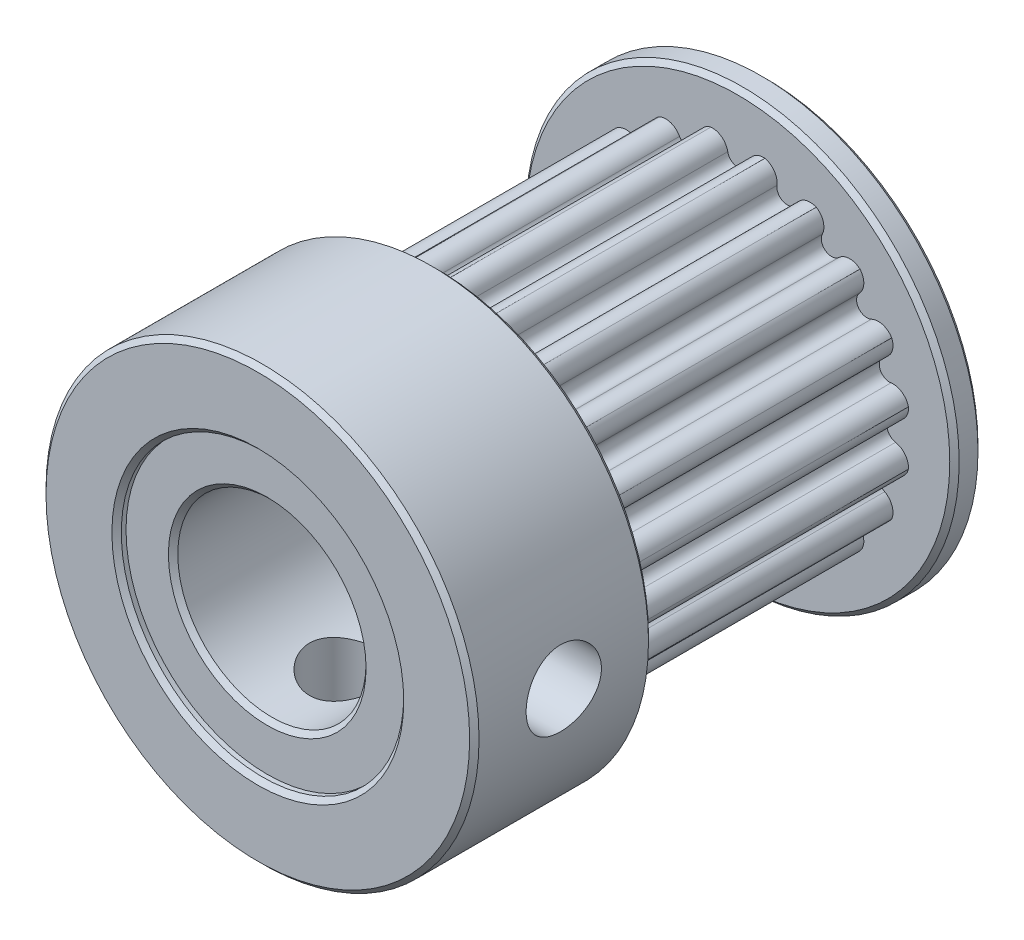
from build123d import *

# Parameters (mm, degrees)
ESQUISSE1_R                  = 11.5
ESQUISSE1_R_2                = 5
BOSS_EXTRU_1_DEPTH           = 27
ESQUISSE2_R                  = 11.5
ESQUISSE2_R_2                = 9.17
ENL_V_MAT_EXTRU_1_DEPTH      = 16
ENL_V_START                  = 16
ENL_V_MAT_EXTRU_2_DEPTH      = 16
R_P_TITION_CIRCULAIRE1_COUNT = 20
ESQUISSE4_R                  = 2
ENL_V_MAT_EXTRU_3_DEPTH      = 16
R_P_TITION_CIRCULAIRE2_COUNT = 2
R_P_TITION_CIRCULAIRE2_ANGLE = 90
ESQUISSE5_R                  = 7.5
ENL_V_MAT_EXTRU_4_DEPTH      = 0.5
CHANFREIN1_SIZE              = 0.25


with BuildPart() as part:
    # Esquisse1 → Boss.-Extru.1 (new body)
    with BuildSketch(Plane.XY):
        Circle(ESQUISSE1_R)
        Circle(ESQUISSE1_R_2, mode=Mode.SUBTRACT)
    extrude(amount=BOSS_EXTRU_1_DEPTH)

    # Esquisse2 → Enlèv. mat.-Extru.1 (cut)
    with BuildSketch(Plane(origin=(0, 0, 1.5), x_dir=(-1, 0, 0), z_dir=(0, 0, -1))):
        Circle(ESQUISSE2_R)
        Circle(ESQUISSE2_R_2, mode=Mode.SUBTRACT)
    extrude(amount=-ENL_V_MAT_EXTRU_1_DEPTH, mode=Mode.SUBTRACT)

    # Esquisse3 → Enlèv. mat.-Extru.2 (cut)
    with BuildSketch(Plane(origin=(0, 0, 17.5), x_dir=(-1, 0, 0), z_dir=(0, 0, -1)).offset(ENL_V_START)):
        with BuildLine():
            ThreePointArc((-1.5, 9.046485505), (-0.88232463, 8.905445978), (-0.541125011, 8.371594096))
            ThreePointArc((-0.541125011, 8.371594096), (0, 7.92), (0.541125011, 8.371594096))
            ThreePointArc((0.541125011, 8.371594096), (0.88232463, 8.905445978), (1.5, 9.046485505))
            ThreePointArc((1.5, 9.046485505), (0, 9.17), (-1.5, 9.046485505))
        make_face()
    enl_v_mat_extru_2 = extrude(amount=-ENL_V_MAT_EXTRU_2_DEPTH, mode=Mode.SUBTRACT)

    # Répétition circulaire1: Enlèv. mat.-Extru.2 ×20 about axis
    r_p_tition_circulaire1_axis = Axis((0, 0, 0), (0, 0, 1))
    for i in range(1, R_P_TITION_CIRCULAIRE1_COUNT):
        add(enl_v_mat_extru_2.rotate(r_p_tition_circulaire1_axis, i * 360 / R_P_TITION_CIRCULAIRE1_COUNT), mode=Mode.SUBTRACT)

    # Esquisse4 → Enlèv. mat.-Extru.3 (cut)
    with BuildSketch(Plane(origin=(0, 0, 0), x_dir=(1, 0, 0), z_dir=(0, 1, 0))):
        with Locations(Location((0, -22.25, 0), (0, 0, 270))):
            Circle(ESQUISSE4_R)
    enl_v_mat_extru_3 = extrude(amount=-ENL_V_MAT_EXTRU_3_DEPTH, mode=Mode.SUBTRACT)

    # Répétition circulaire2: Enlèv. mat.-Extru.3 ×2 about axis
    r_p_tition_circulaire2_axis = Axis((0, 0, 27), (0, 0, 1))
    for i in range(1, R_P_TITION_CIRCULAIRE2_COUNT):
        add(enl_v_mat_extru_3.rotate(r_p_tition_circulaire2_axis, i * R_P_TITION_CIRCULAIRE2_ANGLE / (R_P_TITION_CIRCULAIRE2_COUNT - 1)), mode=Mode.SUBTRACT)

    # Esquisse5 → Enlèv. mat.-Extru.4 (cut)
    with BuildSketch(Plane(origin=(0, 0, 0), x_dir=(-1, 0, 0), z_dir=(0, 0, -1))):
        Circle(ESQUISSE5_R)
    enl_v_mat_extru_4 = extrude(amount=-ENL_V_MAT_EXTRU_4_DEPTH, mode=Mode.SUBTRACT)

    # Symétrie1: Enlèv. mat.-Extru.4 across plane
    add(enl_v_mat_extru_4.mirror(Plane(origin=(0, 0, 13.5), x_dir=(1, 0, 0), z_dir=(0, 0, -1))), mode=Mode.SUBTRACT)

    # Chanfrein1
    chanfrein1_edges = [part.edges().sort_by_distance(p)[0] for p in [
        (-11.5, 0, 17.5),
        (-11.5, 0, 1.5),
        (-5, 0, 0.5),
        (7.5, 0, 0),
        (-11.5, 0, 0),
        (7.5, 0, 27),
        (-5, 0, 26.5),
        (-11.5, 0, 27),
    ]]
    chamfer(chanfrein1_edges, length=CHANFREIN1_SIZE)


solid = part.part
